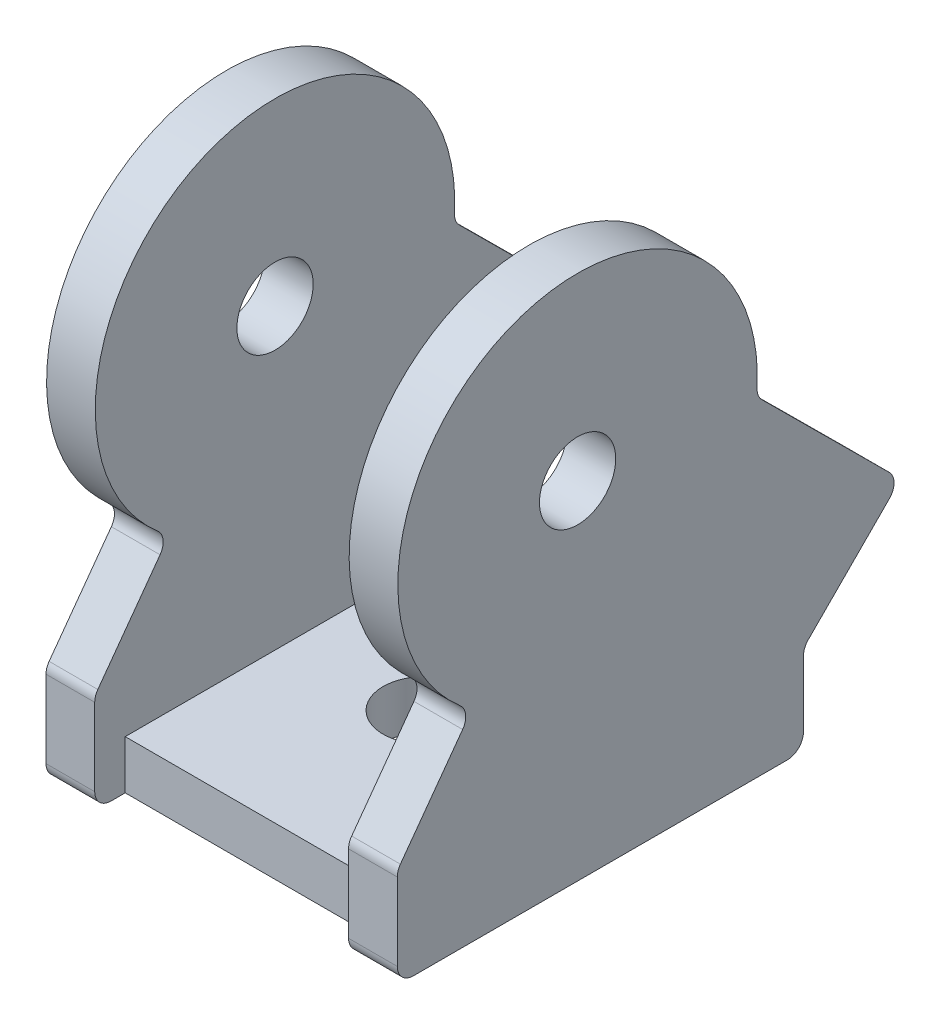
from build123d import *

# Parameters (mm, degrees)
SKETCH3_W           = 31.27
SKETCH3_H           = 42.48
BOSS_EXTRUDE1_DEPTH = 6
SKETCH4_R           = 4.7
BOSS_EXTRUDE2_DEPTH = 6
SKETCH6_R           = 5.1
CUT_EXTRUDE2_DEPTH  = 6
FILLET1_R           = 2
FILLET2_R           = 2


with BuildPart() as part:
    # Sketch3 → Boss-Extrude1 (new body)
    with BuildSketch(Plane(origin=(0, 0, 0), x_dir=(1, 0, 0), z_dir=(0, 1, 0))):
        Rectangle(SKETCH3_W, SKETCH3_H)
    extrude(amount=BOSS_EXTRUDE1_DEPTH)

    # Sketch4 → Boss-Extrude2 (add)
    with BuildSketch(Plane(origin=(15.635, 0, 0), x_dir=(0, 0, -1), z_dir=(1, 0, 0))):
        with BuildLine():
            Line((-24.997886253, 0), (25.03656642, 0))
            Line((25.03656642, 0), (25.03656642, 10.942584388))
            Line((25.03656642, 10.942584388), (37.020669589, 23))
            Line((37.020669589, 23), (19.258864986, 40.653807887))
            ThreePointArc((19.258864986, 40.653807887), (-11.905269618, 62.875361443), (-15.817481327, 24.800496669))
            Line((-15.817481327, 24.800496669), (-24.997886253, 12.19))
            Line((-24.997886253, 12.19), (-24.997886253, 0))
        make_face()
        with Locations((-2.786694922, 42.7)):
            Circle(SKETCH4_R, mode=Mode.SUBTRACT)
    boss_extrude2 = extrude(amount=BOSS_EXTRUDE2_DEPTH)

    # Mirror2: Boss-Extrude2 across plane
    add(boss_extrude2.mirror(Plane(origin=(0, 0, 0), x_dir=(0, 0, 1), z_dir=(1, 0, 0))))

    # Sketch6 → Cut-Extrude2 (cut)
    with BuildSketch(Plane.XZ):
        with Locations(Location((0, 0, 0), (0, 0, 270))):
            Circle(SKETCH6_R)
    extrude(amount=-CUT_EXTRUDE2_DEPTH, mode=Mode.SUBTRACT)

    # Fillet1
    fillet1_edges = [part.edges().sort_by_distance(p)[0] for p in [
        (-18.635, 12.19, 24.997886253),
        (-18.635, 0, 24.997886253),
        (18.635, 10.942584388, -25.03656642),
        (-18.635, 10.942584388, -25.03656642),
        (-18.635, 0, -25.03656642),
        (18.635, 0, -25.03656642),
        (18.635, 0, 24.997886253),
        (18.635, 12.19, 24.997886253),
        (18.635, 24.800496669, 15.817481327),
        (-18.635, 24.800496669, 15.817481327),
        (18.635, 23, -37.020669589),
        (-18.635, 23, -37.020669589),
    ]]
    fillet(fillet1_edges, radius=FILLET1_R)

    # Fillet2
    fillet2_edges = [part.edges().sort_by_distance(p)[0] for p in [
        (18.635, 40.653807887, -19.258864986),
        (-18.635, 40.653807887, -19.258864986),
    ]]
    fillet(fillet2_edges, radius=FILLET2_R)


solid = part.part
